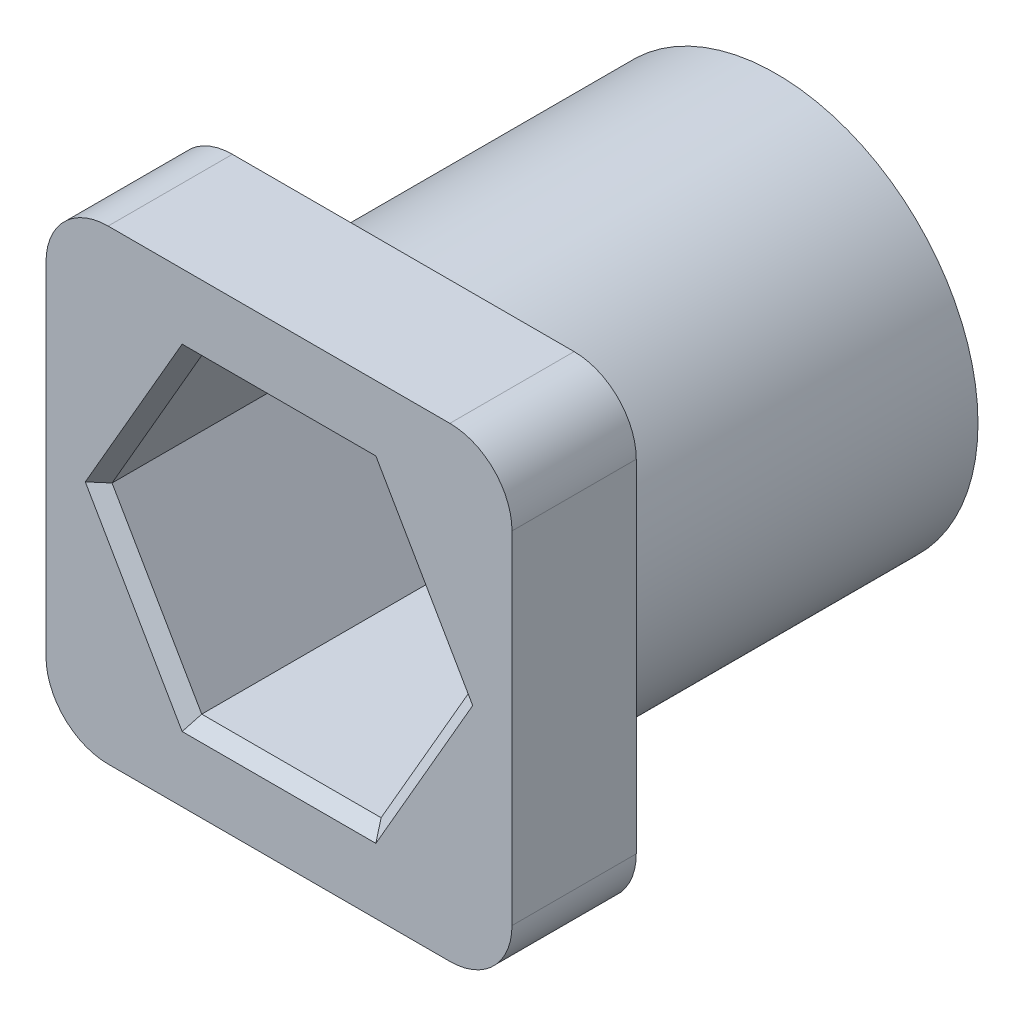
from build123d import *

# Parameters (mm, degrees)
SKETCH1_W           = 19.05
SKETCH1_H           = 19.05
BOSS_EXTRUDE1_DEPTH = 5.08
SKETCH2_R           = 8.255
BOSS_EXTRUDE2_DEPTH = 15.24
CUT_EXTRUDE1_DEPTH  = 25.379369352
FILLET1_R           = 2.54
CHAMFER1_SIZE       = 0.508


with BuildPart() as part:
    # Sketch1 → Boss-Extrude1 (new body)
    with BuildSketch(Plane.XY):
        Rectangle(SKETCH1_W, SKETCH1_H)
    extrude(amount=-BOSS_EXTRUDE1_DEPTH)

    # Sketch2 → Boss-Extrude2 (add)
    with BuildSketch(Plane(origin=(0, 0, -5.08), x_dir=(-1, 0, 0), z_dir=(0, 0, -1))):
        with Locations(Location((0, 0, 0), (0, 0, 180))):
            Circle(SKETCH2_R)
    extrude(amount=BOSS_EXTRUDE2_DEPTH)

    # Sketch3 → Cut-Extrude1 (cut, through all)
    with BuildSketch(Plane.XY):
        Polygon((3.666174209, 6.35), (-3.666174209, 6.35), (-7.332348419, 0), (-3.666174209, -6.35), (3.666174209, -6.35), (7.332348419, 0), align=None)
    extrude(amount=-CUT_EXTRUDE1_DEPTH, mode=Mode.SUBTRACT)

    # Fillet1
    fillet1_edges = [part.edges().sort_by_distance(p)[0] for p in [
        (9.525, -9.525, -2.54),
        (-9.525, -9.525, -2.54),
        (-9.525, 9.525, -2.54),
        (9.525, 9.525, -2.54),
    ]]
    fillet(fillet1_edges, radius=FILLET1_R)

    # Chamfer1
    chamfer1_edges = [part.edges().sort_by_distance(p)[0] for p in [
        (5.499261314, 3.175, 0),
        (0, 6.35, 0),
        (-5.499261314, 3.175, 0),
        (-5.499261314, -3.175, 0),
        (0, -6.35, 0),
        (5.499261314, -3.175, 0),
    ]]
    chamfer(chamfer1_edges, length=CHAMFER1_SIZE)


solid = part.part
